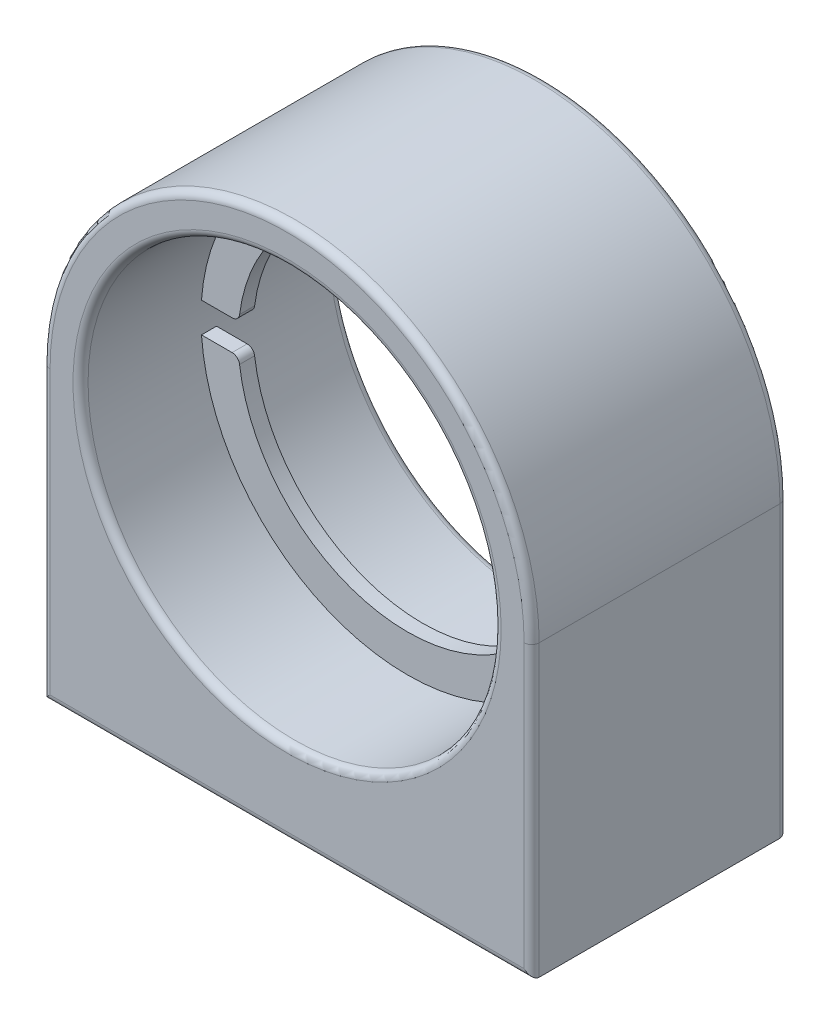
from build123d import *

# Parameters (mm, degrees)
AUFSATZ_LINEAR_AUSTRAGEN1_DEPTH = 17
SKIZZE3_R                       = 27.45
SCHNITT_LINEAR_AUSTRAGEN1_DEPTH = 16
SKIZZE4_R                       = 2.8
SCHNITT_LINEAR_AUSTRAGEN2_DEPTH = 11
SCHNITT_LINEAR_AUSTRAGEN3_DEPTH = 2
VERRUNDUNG1_R                   = 1


with BuildPart() as part:
    # Skizze1 → Aufsatz-Linear austragen1 (new, symmetric)
    with BuildSketch(Plane.XY):
        with BuildLine():
            ThreePointArc((32.5, 19.25), (0, 51.75), (-32.5, 19.25))
            Line((-32.5, 19.25), (-22.5, 19.25))
            ThreePointArc((-22.5, 19.25), (0, 41.75), (22.5, 19.25))
            Line((22.5, 19.25), (32.5, 19.25))
        make_face()
        with BuildLine():
            Line((-22.5, 19.25), (-32.5, 19.25))
            ThreePointArc((-32.5, 19.25), (0, -13.25), (32.5, 19.25))
            Line((32.5, 19.25), (22.5, 19.25))
            ThreePointArc((22.5, 19.25), (0, -3.25), (-22.5, 19.25))
        make_face()
        with BuildLine():
            Line((-32.5, 19.25), (-32.5, -19.25))
            Line((-32.5, -19.25), (32.5, -19.25))
            Line((32.5, -19.25), (32.5, 19.25))
            ThreePointArc((32.5, 19.25), (0, -13.25), (-32.5, 19.25))
        make_face()
    extrude(amount=AUFSATZ_LINEAR_AUSTRAGEN1_DEPTH, both=True)

    # Skizze3 → Schnitt-Linear austragen1 (cut)
    with BuildSketch(Plane.XY.offset(17)):
        with Locations((0, 19.25)):
            Circle(SKIZZE3_R)
    schnitt_linear_austragen1 = extrude(amount=-SCHNITT_LINEAR_AUSTRAGEN1_DEPTH, mode=Mode.SUBTRACT)

    # Spiegeln1: Schnitt-Linear austragen1 across plane
    add(schnitt_linear_austragen1.mirror(Plane.XY), mode=Mode.SUBTRACT)

    # Skizze4 → Schnitt-Linear austragen2 (cut)
    with BuildSketch(Plane.XZ.offset(19.25)):
        with Locations(Location((-22.5, 0, 0), (0, 0, 270))):
            Circle(SKIZZE4_R)
        with Locations(Location((-10, 0, 0), (0, 0, 270))):
            Circle(SKIZZE4_R)
        with Locations(Location((10, 0, 0), (0, 0, 90))):
            Circle(SKIZZE4_R)
        with Locations(Location((22.5, 0, 0), (0, 0, 90))):
            Circle(SKIZZE4_R)
    extrude(amount=-SCHNITT_LINEAR_AUSTRAGEN2_DEPTH, mode=Mode.SUBTRACT)

    # Skizze5 → Schnitt-Linear austragen3 (cut)
    with BuildSketch(Plane.XY.offset(1)):
        with BuildLine():
            ThreePointArc((-22.410934831, 17.25), (-22.5, 19.25), (-22.410934831, 21.25))
            Line((-22.410934831, 21.25), (-27.377043303, 21.25))
            ThreePointArc((-27.377043303, 21.25), (-27.45, 19.25), (-27.377043303, 17.25))
            Line((-27.377043303, 17.25), (-22.410934831, 17.25))
        make_face()
        with BuildLine():
            ThreePointArc((22.410934831, 21.25), (22.477722679, 20.250991084), (22.5, 19.25))
            Line((22.5, 19.25), (27.45, 19.25))
            ThreePointArc((27.45, 19.25), (27.431754762, 20.250665114), (27.377043303, 21.25))
            Line((27.377043303, 21.25), (22.410934831, 21.25))
        make_face()
        with BuildLine():
            Line((27.45, 19.25), (22.5, 19.25))
            ThreePointArc((22.5, 19.25), (22.477722679, 18.249008916), (22.410934831, 17.25))
            Line((22.410934831, 17.25), (27.377043303, 17.25))
            ThreePointArc((27.377043303, 17.25), (27.431754762, 18.249334886), (27.45, 19.25))
        make_face()
    extrude(amount=-SCHNITT_LINEAR_AUSTRAGEN3_DEPTH, mode=Mode.SUBTRACT)

    # Verrundung1
    verrundung1_edges = [part.edges().sort_by_distance(p)[0] for p in [
        (-32.5, 0, 17),
        (0, -19.25, 17),
        (32.5, 0, 17),
        (-27.45, 19.25, 17),
        (-27.45, 19.25, -17),
        (-22.5, -19.25, 2.8),
        (-10, -19.25, 2.8),
        (10, -19.25, -2.8),
        (22.5, -19.25, -2.8),
        (0, 51.75, 17),
        (-22.410934831, 17.25, 0),
        (-22.410934831, 21.25, 0),
        (22.410934831, 21.25, 0),
        (22.410934831, 17.25, 0),
        (32.5, 0, -17),
        (0, -19.25, -17),
        (-32.5, 0, -17),
        (0, 51.75, -17),
    ]]
    fillet(verrundung1_edges, radius=VERRUNDUNG1_R)


solid = part.part
